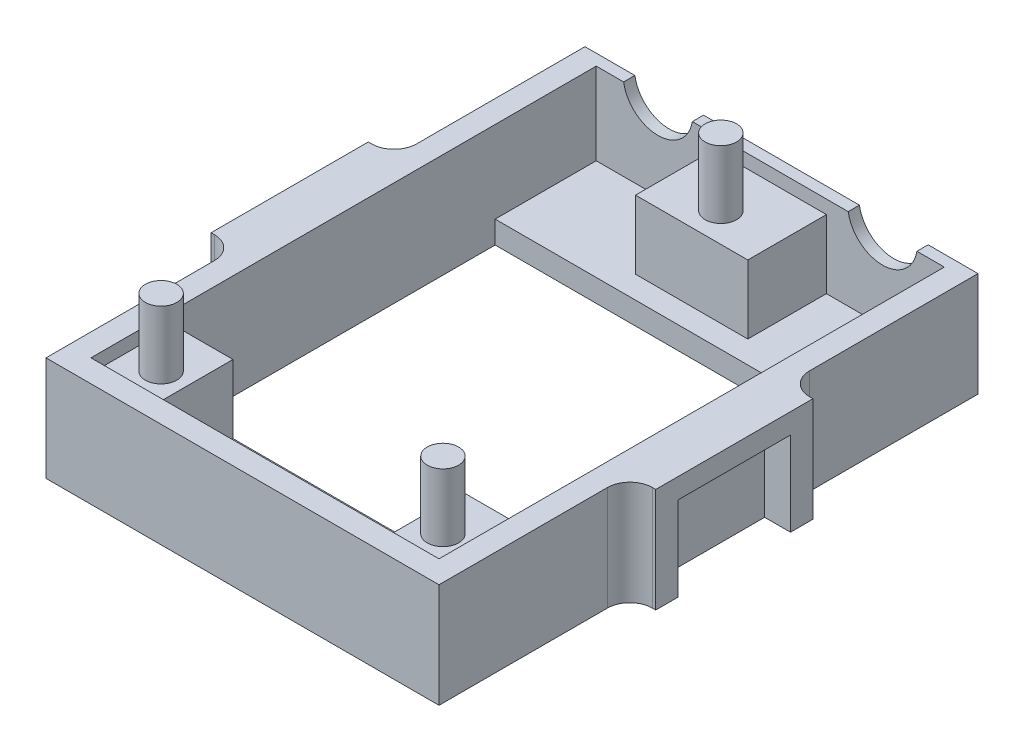
from build123d import *

# Parameters (mm, degrees)
SKETCH1_W           = 35
SKETCH1_H           = 48
BOSS_EXTRUDE1_DEPTH = 2
SKETCH2_W           = 35
SKETCH2_H           = 48
SKETCH2_W_2         = 31
SKETCH2_H_2         = 44
BOSS_EXTRUDE2_DEPTH = 7.3
SKETCH3_W           = 10
SKETCH3_H           = 7
SKETCH3_W_2         = 5.25
SKETCH3_H_2         = 6.4
BOSS_EXTRUDE3_DEPTH = 6.1
CUT_EXTRUDE5_DEPTH  = 1
SKETCH10_W          = 31
SKETCH10_H          = 28.6
CUT_EXTRUDE6_DEPTH  = 31.586598372
BOSS_EXTRUDE4_START = 8.1
SKETCH8_R           = 1.4
BOSS_EXTRUDE4_DEPTH = 6
SKETCH14_W          = 2.3
SKETCH14_H          = 1.8
BOSS_EXTRUDE6_DEPTH = 5
SKETCH15_W          = 2
SKETCH15_H          = 9.3
BOSS_EXTRUDE7_DEPTH = 2.3
FILLET3_R           = 2
SKETCH16_W          = 31
SKETCH16_H          = 1
CUT_EXTRUDE8_DEPTH  = 1.2


with BuildPart() as part:
    # Sketch1 → Boss-Extrude1 (new body)
    with BuildSketch(Plane(origin=(0, 0, 0), x_dir=(1, 0, 0), z_dir=(0, 1, 0))):
        Rectangle(SKETCH1_W, SKETCH1_H)
    extrude(amount=BOSS_EXTRUDE1_DEPTH)

    # Sketch2 → Boss-Extrude2 (add)
    with BuildSketch(Plane(origin=(0, 2, 0), x_dir=(1, 0, 0), z_dir=(0, 1, 0))):
        Rectangle(SKETCH2_W, SKETCH2_H)
        with Locations((0, 1)):
            Rectangle(SKETCH2_W_2, SKETCH2_H_2, mode=Mode.SUBTRACT)
    extrude(amount=BOSS_EXTRUDE2_DEPTH)

    # Sketch3 → Boss-Extrude3 (add)
    with BuildSketch(Plane(origin=(0, 2, 0), x_dir=(1, 0, 0), z_dir=(0, 1, 0))):
        with Locations((0, 19.5)):
            Rectangle(SKETCH3_W, SKETCH3_H)
        with Locations((-12.875, -17.8)):
            Rectangle(SKETCH3_W_2, SKETCH3_H_2)
        with Locations((12.875, -17.8)):
            Rectangle(SKETCH3_W_2, SKETCH3_H_2)
    extrude(amount=BOSS_EXTRUDE3_DEPTH)

    # Sketch6 → Cut-Extrude5 (cut)
    with BuildSketch(Plane(origin=(0, 0, -24), x_dir=(-1, 0, 0), z_dir=(0, 0, -1))):
        with BuildLine():
            ThreePointArc((-13.059411708, 9.3), (-10, 6.7), (-6.940588292, 9.3))
            Line((-6.940588292, 9.3), (-13.059411708, 9.3))
        make_face()
        with BuildLine():
            Line((13.059411708, 9.3), (6.940588292, 9.3))
            ThreePointArc((6.940588292, 9.3), (10, 6.7), (13.059411708, 9.3))
        make_face()
    extrude(amount=-CUT_EXTRUDE5_DEPTH, mode=Mode.SUBTRACT)

    # Sketch10 → Cut-Extrude6 (cut, through all)
    with BuildSketch(Plane(origin=(0, 2, 0), x_dir=(1, 0, 0), z_dir=(0, 1, 0))):
        with Locations((0, -0.3)):
            Rectangle(SKETCH10_W, SKETCH10_H)
    extrude(amount=-CUT_EXTRUDE6_DEPTH, mode=Mode.SUBTRACT)

    # Sketch8 → Boss-Extrude4 (add)
    with BuildSketch(Plane(origin=(0, 0, 0), x_dir=(1, 0, 0), z_dir=(0, 1, 0)).offset(BOSS_EXTRUDE4_START)):
        with Locations(Location((-12.55, -18.7, 0), (0, 0, 90))):
            Circle(SKETCH8_R)
        with Locations(Location((12.55, -18.7, 0), (0, 0, 270))):
            Circle(SKETCH8_R)
        with Locations(Location((0, 18.6, 0), (0, 0, 270))):
            Circle(SKETCH8_R)
    extrude(amount=BOSS_EXTRUDE4_DEPTH)

    # Sketch14 → Boss-Extrude6 (add, symmetric)
    with BuildSketch(Plane.XY):
        with Locations((18.65, 8.4)):
            Rectangle(SKETCH14_W, SKETCH14_H)
    boss_extrude6 = extrude(amount=BOSS_EXTRUDE6_DEPTH, both=True)

    # Sketch15 → Boss-Extrude7 (add)
    with BuildSketch(Plane(origin=(17.5, 0, 0), x_dir=(0, 0, -1), z_dir=(1, 0, 0))):
        with Locations((-6, 4.65)):
            Rectangle(SKETCH15_W, SKETCH15_H)
        with Locations((6, 4.65)):
            Rectangle(SKETCH15_W, SKETCH15_H)
    boss_extrude7 = extrude(amount=BOSS_EXTRUDE7_DEPTH)

    # Mirror3: Boss-Extrude6, Boss-Extrude7 across plane
    add(boss_extrude6.mirror(Plane(origin=(0, 0, 0), x_dir=(0, 0, 1), z_dir=(1, 0, 0))))
    add(boss_extrude7.mirror(Plane(origin=(0, 0, 0), x_dir=(0, 0, 1), z_dir=(1, 0, 0))))

    # Fillet3
    fillet3_edges = [part.edges().sort_by_distance(p)[0] for p in [
        (17.5, 4.65, 7),
        (17.5, 4.65, -7),
        (-17.5, 4.65, 7),
        (-17.5, 4.65, -7),
    ]]
    fillet(fillet3_edges, radius=FILLET3_R)

    # Sketch16 → Cut-Extrude8 (cut)
    with BuildSketch(Plane(origin=(0, 9.3, 0), x_dir=(1, 0, 0), z_dir=(0, 1, 0))):
        with Locations((0, -21.5)):
            Rectangle(SKETCH16_W, SKETCH16_H)
    extrude(amount=-CUT_EXTRUDE8_DEPTH, mode=Mode.SUBTRACT)


solid = part.part
